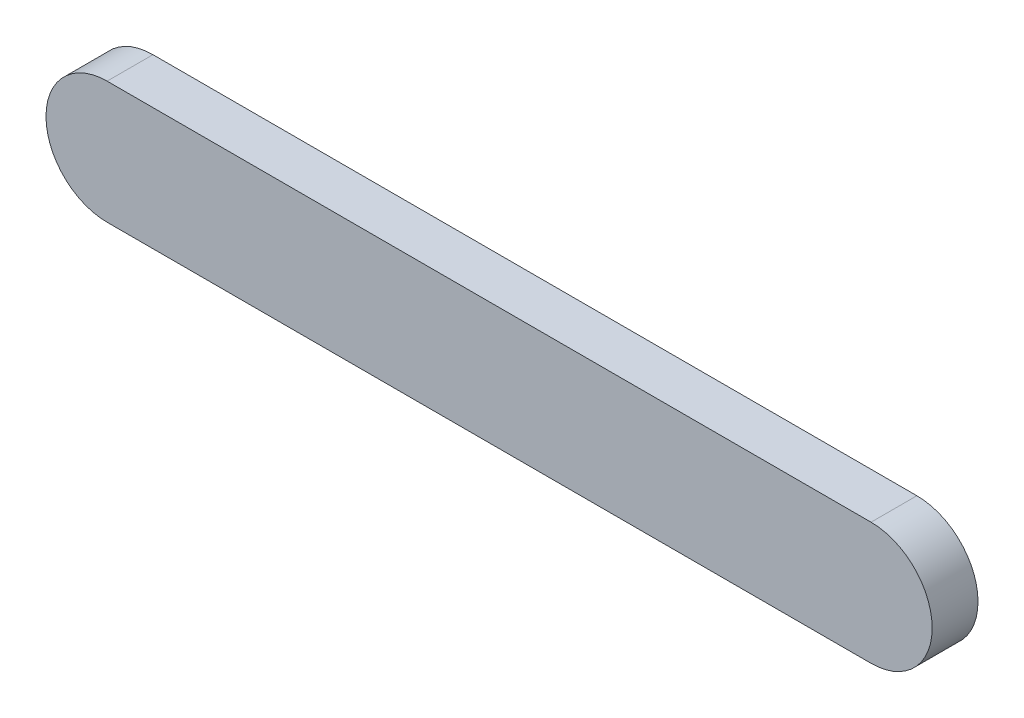
from build123d import *

# Parameters (mm, degrees)
EXTRUDE_1_DEPTH = 3


with BuildPart() as part:
    # 草图1 → 拉伸1 (new body)
    with BuildSketch(Plane.XY):
        with BuildLine():
            Line((-10.927568014, 3.846503941), (39.072431986, 3.846503941))
            ThreePointArc((39.072431986, 3.846503941), (43.072431986, -0.153496059), (39.072431986, -4.153496059))
            Line((39.072431986, -4.153496059), (-10.927568014, -4.153496059))
            ThreePointArc((-10.927568014, -4.153496059), (-14.927568014, -0.153496059), (-10.927568014, 3.846503941))
        make_face()
    extrude(amount=EXTRUDE_1_DEPTH)


solid = part.part
